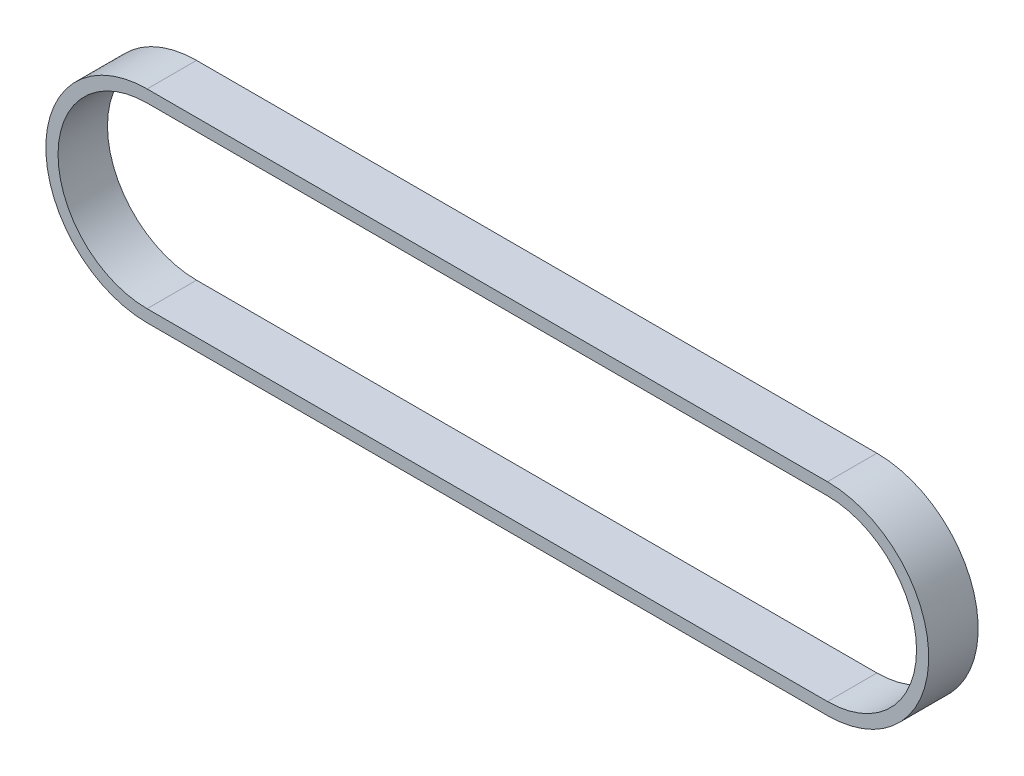
from build123d import *

# Parameters (mm, degrees)
RESSALTO_EXTRUS_O1_DEPTH = 9.52


with BuildPart() as part:
    # Esboço1 → Ressalto-extrusão1 (new body)
    with BuildSketch(Plane.XY):
        with BuildLine():
            Line((0, 19.5), (131, 19.5))
            ThreePointArc((131, 19.5), (150.5, 0), (131, -19.5))
            Line((131, -19.5), (0, -19.5))
            ThreePointArc((0, -19.5), (-19.5, 0), (0, 19.5))
        make_face()
        with BuildLine():
            Line((0, 17.15), (131, 17.15))
            ThreePointArc((131, 17.15), (148.15, 0), (131, -17.15))
            Line((131, -17.15), (0, -17.15))
            ThreePointArc((0, -17.15), (-17.15, 0), (0, 17.15))
        make_face(mode=Mode.SUBTRACT)
    extrude(amount=RESSALTO_EXTRUS_O1_DEPTH)


solid = part.part
